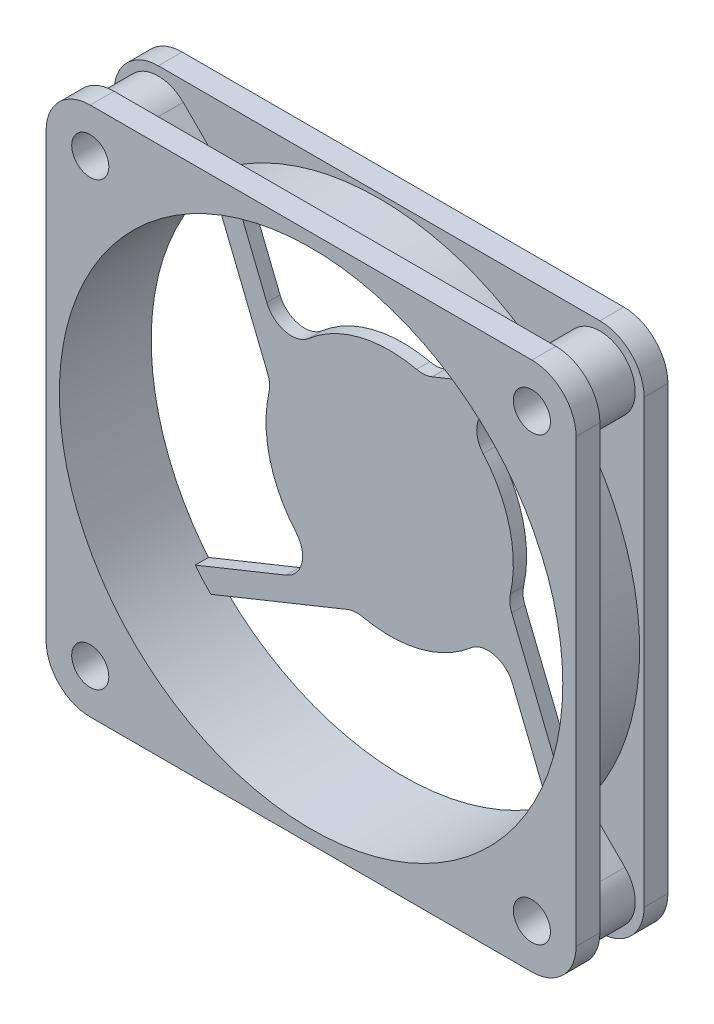
from build123d import *

# Parameters (mm, degrees)
ESQUISSE1_R             = 28.5
ESQUISSE1_R_2           = 2.1
BOSS_EXTRU_1_DEPTH      = 10.4
ENL_V_MAT_EXTRU_1_DEPTH = 2.5
BOSS_EXTRU_2_DEPTH      = 1.5


with BuildPart() as part:
    # Esquisse1 → Boss.-Extru.1 (new body)
    with BuildSketch(Plane.XY):
        with BuildLine():
            Line((5, 60), (55, 60))
            ThreePointArc((55, 60), (58.535533906, 58.535533906), (60, 55))
            Line((60, 55), (60, 5))
            ThreePointArc((60, 5), (58.535533906, 1.464466094), (55, 0))
            Line((55, 0), (5, 0))
            ThreePointArc((5, 0), (1.464466094, 1.464466094), (0, 5))
            Line((0, 5), (0, 55))
            ThreePointArc((0, 55), (1.464466094, 58.535533906), (5, 60))
        make_face()
        with Locations((30, 30)):
            Circle(ESQUISSE1_R, mode=Mode.SUBTRACT)
        with Locations((55, 55)):
            Circle(ESQUISSE1_R_2, mode=Mode.SUBTRACT)
        with Locations(Location((5, 55, 0), (0, 0, 180))):
            Circle(ESQUISSE1_R_2, mode=Mode.SUBTRACT)
        with Locations(Location((55, 5, 0), (0, 0, 180))):
            Circle(ESQUISSE1_R_2, mode=Mode.SUBTRACT)
        with Locations((5, 5)):
            Circle(ESQUISSE1_R_2, mode=Mode.SUBTRACT)
    extrude(amount=BOSS_EXTRU_1_DEPTH)

    # Esquisse2 → Enlèv. mat.-Extru.1 (cut, symmetric)
    with BuildSketch(Plane.XY.offset(5.2)):
        with BuildLine():
            Line((5, 0), (55, 0))
            ThreePointArc((55, 0), (58.535533906, 1.464466094), (60, 5))
            Line((60, 5), (60, 55))
            ThreePointArc((60, 55), (58.535533906, 58.535533906), (55, 60))
            Line((55, 60), (5, 60))
            ThreePointArc((5, 60), (1.464466094, 58.535533906), (0, 55))
            Line((0, 55), (0, 5))
            ThreePointArc((0, 5), (1.464466094, 1.464466094), (5, 0))
        make_face()
        with BuildLine():
            Line((2.171572875, 52.171572875), (6.50457019, 47.838575561))
            ThreePointArc((6.50457019, 47.838575561), (0.5, 30), (6.50457019, 12.161424439))
            Line((6.50457019, 12.161424439), (2.171572875, 7.828427125))
            ThreePointArc((2.171572875, 7.828427125), (2.171572875, 2.171572875), (7.828427125, 2.171572875))
            Line((7.828427125, 2.171572875), (12.161424439, 6.50457019))
            ThreePointArc((12.161424439, 6.50457019), (30, 0.5), (47.838575561, 6.50457019))
            Line((47.838575561, 6.50457019), (52.171572875, 2.171572875))
            ThreePointArc((52.171572875, 2.171572875), (57.828427125, 2.171572875), (57.828427125, 7.828427125))
            Line((57.828427125, 7.828427125), (53.49542981, 12.161424439))
            ThreePointArc((53.49542981, 12.161424439), (59.5, 30), (53.49542981, 47.838575561))
            Line((53.49542981, 47.838575561), (57.828427125, 52.171572875))
            ThreePointArc((57.828427125, 52.171572875), (57.828427125, 57.828427125), (52.171572875, 57.828427125))
            Line((52.171572875, 57.828427125), (47.838575561, 53.49542981))
            ThreePointArc((47.838575561, 53.49542981), (30, 59.5), (12.161424439, 53.49542981))
            Line((12.161424439, 53.49542981), (7.828427125, 57.828427125))
            ThreePointArc((7.828427125, 57.828427125), (2.171572875, 57.828427125), (2.171572875, 52.171572875))
        make_face(mode=Mode.SUBTRACT)
    extrude(amount=ENL_V_MAT_EXTRU_1_DEPTH, both=True, mode=Mode.SUBTRACT)


with BuildPart() as body_2:
    # Esquisse3 → Boss.-Extru.2 (new body)
    with BuildSketch(Plane(origin=(0, 0, 0), x_dir=(-1, 0, 0), z_dir=(0, 0, -1))):
        with BuildLine():
            Line((-43.906875019, 18.269747351), (-48.071463829, 7.962028336))
            ThreePointArc((-48.071463829, 7.962028336), (-49.08055505, 8.829680707), (-50.048041717, 9.743494297))
            Line((-50.048041717, 9.743494297), (-43.81159756, 25.179235243))
            ThreePointArc((-43.81159756, 25.179235243), (-43.603322258, 26.056204232), (-43.664946337, 26.955457078))
            ThreePointArc((-43.664946337, 26.955457078), (-43.574743293, 33.424375055), (-40.585706707, 39.162031081))
            ThreePointArc((-40.585706707, 39.162031081), (-39.937719121, 41.828802935), (-41.730252649, 43.906875019))
            Line((-41.730252649, 43.906875019), (-52.037971664, 48.071463829))
            ThreePointArc((-52.037971664, 48.071463829), (-51.170319293, 49.08055505), (-50.256505703, 50.048041717))
            Line((-50.256505703, 50.048041717), (-34.820764757, 43.81159756))
            ThreePointArc((-34.820764757, 43.81159756), (-33.943795768, 43.603322258), (-33.044542922, 43.664946337))
            ThreePointArc((-33.044542922, 43.664946337), (-26.575624945, 43.574743293), (-20.837968919, 40.585706707))
            ThreePointArc((-20.837968919, 40.585706707), (-18.171197065, 39.937719121), (-16.093124981, 41.730252649))
            Line((-16.093124981, 41.730252649), (-11.928536171, 52.037971664))
            ThreePointArc((-11.928536171, 52.037971664), (-10.91944495, 51.170319293), (-9.951958283, 50.256505703))
            Line((-9.951958283, 50.256505703), (-16.18840244, 34.820764757))
            ThreePointArc((-16.18840244, 34.820764757), (-16.396677742, 33.943795768), (-16.335053663, 33.044542922))
            ThreePointArc((-16.335053663, 33.044542922), (-16.425256707, 26.575624945), (-19.414293293, 20.837968919))
            ThreePointArc((-19.414293293, 20.837968919), (-20.062280879, 18.171197065), (-18.269747351, 16.093124981))
            Line((-18.269747351, 16.093124981), (-7.962028336, 11.928536171))
            ThreePointArc((-7.962028336, 11.928536171), (-8.829680707, 10.91944495), (-9.743494297, 9.951958283))
            Line((-9.743494297, 9.951958283), (-25.179235243, 16.18840244))
            ThreePointArc((-25.179235243, 16.18840244), (-26.056204232, 16.396677742), (-26.955457078, 16.335053663))
            ThreePointArc((-26.955457078, 16.335053663), (-33.424375055, 16.425256707), (-39.162031081, 19.414293293))
            ThreePointArc((-39.162031081, 19.414293293), (-41.828802935, 20.062280879), (-43.906875019, 18.269747351))
        make_face()
    extrude(amount=-BOSS_EXTRU_2_DEPTH)


solid = Compound([part.part, body_2.part])
